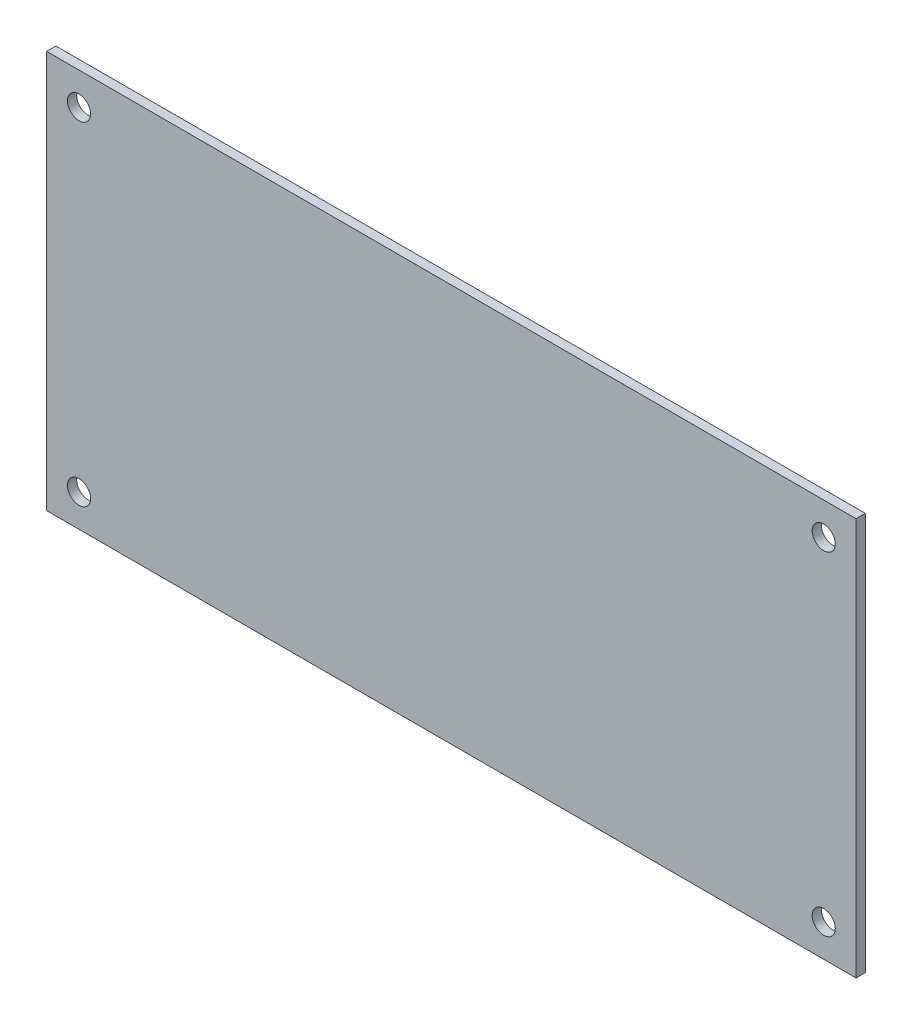
from build123d import *

# Parameters (mm, degrees)
IZIM1_W                     = 175
IZIM1_H                     = 86
IZIM1_R                     = 2.5
Y_KSEKLIK_EKSTR_ZYON1_DEPTH = 2


with BuildPart() as part:
    # Çizim1 → Yükseklik-Ekstrüzyon1 (new body)
    with BuildSketch(Plane.XY):
        with Locations((87.5, 43)):
            Rectangle(IZIM1_W, IZIM1_H)
        with Locations((7, 79)):
            Circle(IZIM1_R, mode=Mode.SUBTRACT)
        with Locations((168, 79)):
            Circle(IZIM1_R, mode=Mode.SUBTRACT)
        with Locations((7, 7)):
            Circle(IZIM1_R, mode=Mode.SUBTRACT)
        with Locations((168, 7)):
            Circle(IZIM1_R, mode=Mode.SUBTRACT)
    extrude(amount=Y_KSEKLIK_EKSTR_ZYON1_DEPTH)


solid = part.part
